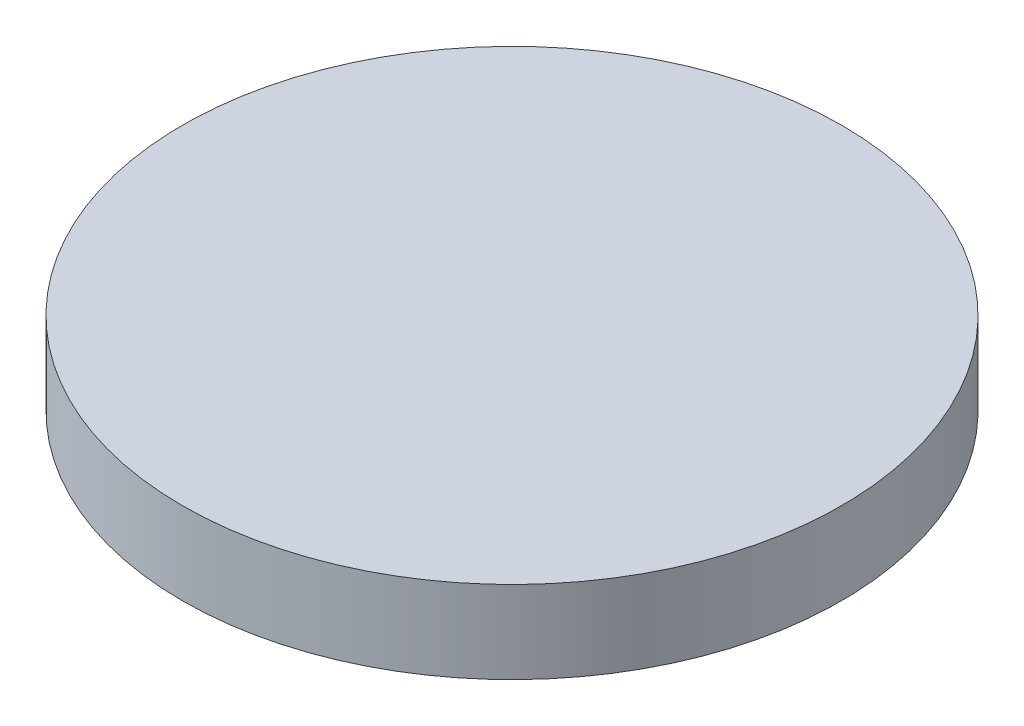
from build123d import *

# Parameters (mm, degrees)
ESQUISSE1_R        = 400
BOSS_EXTRU_1_DEPTH = 100


with BuildPart() as part:
    # Esquisse1 → Boss.-Extru.1 (new body)
    with BuildSketch(Plane(origin=(0, 0, 0), x_dir=(1, 0, 0), z_dir=(0, 1, 0))):
        with Locations(Location((0, 0, 0), (0, 0, 270))):
            Circle(ESQUISSE1_R)
    extrude(amount=BOSS_EXTRU_1_DEPTH)


solid = part.part
